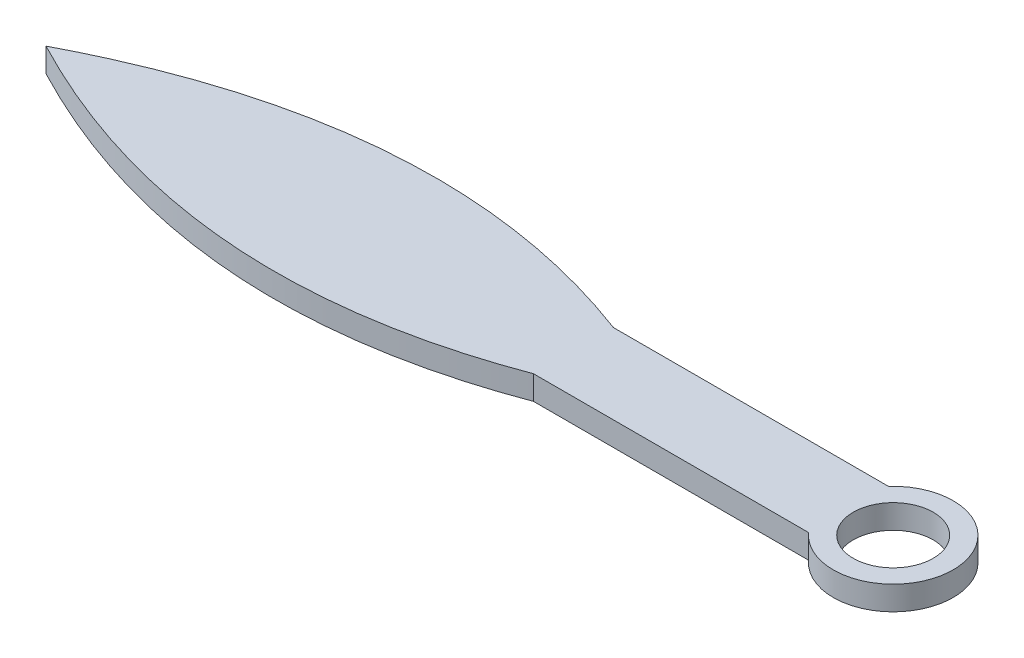
from build123d import *

# Parameters (mm, degrees)
SKETCH1_R           = 12.7
BOSS_EXTRUDE1_DEPTH = 7.62


with BuildPart() as part:
    # Sketch1 → Boss-Extrude1 (new body)
    with BuildSketch(Plane(origin=(0, 0, 0), x_dir=(1, 0, 0), z_dir=(0, 1, 0))):
        with BuildLine():
            Line((-14.199031657, 12.7), (-101.6, 12.7))
            add(Edge.make_bspline(
                [(-101.6, 12.7), (-184.883349987, 44.014741237), (-269.184277242, 0)],
                knots=[0, 0, 0, 1, 1, 1], degree=2))
            add(Edge.make_bspline(
                [(-101.6, -12.7), (-184.883349987, -44.014741237), (-269.184277242, 0)],
                knots=[0, 0, 0, 1, 1, 1], degree=2))
            Line((-101.6, -12.7), (-14.199031657, -12.7))
            ThreePointArc((-14.199031657, -12.7), (19.05, 0), (-14.199031657, 12.7))
        make_face()
        with Locations(Location((0, 0, 0), (0, 0, 90))):
            Circle(SKETCH1_R, mode=Mode.SUBTRACT)
    extrude(amount=BOSS_EXTRUDE1_DEPTH)


solid = part.part
